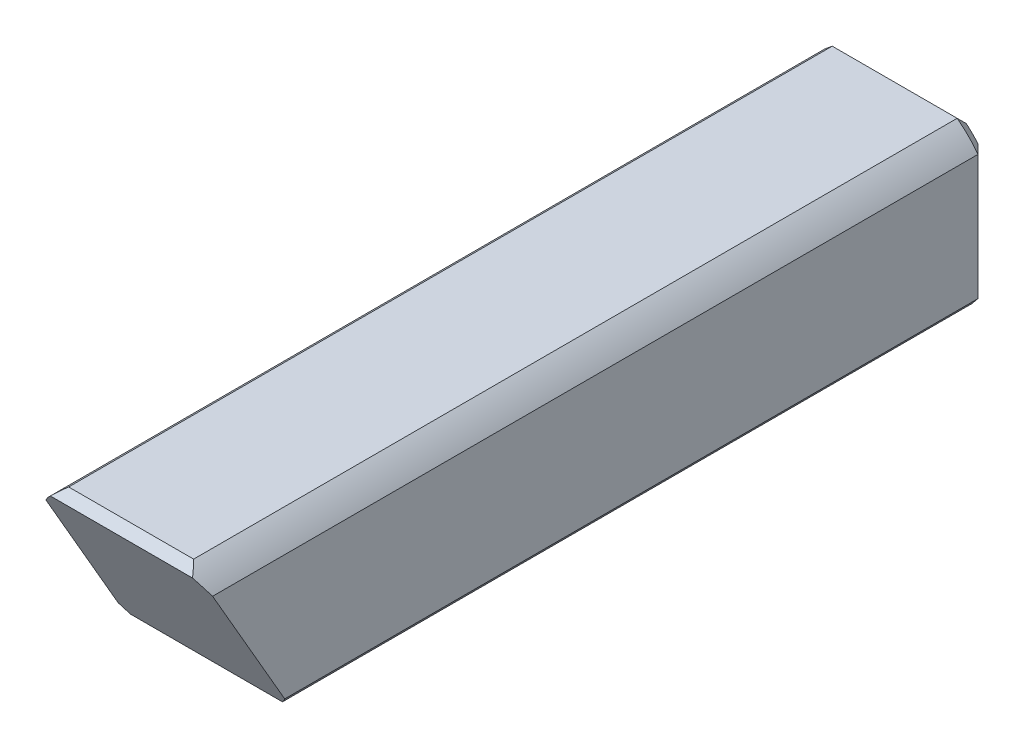
from build123d import *
from OCP.BRepFilletAPI import BRepFilletAPI_MakeChamfer

# Parameters (mm, degrees)
SKETCH_1_W          = 60
SKETCH_1_H          = 60
EXTRUDE_1_DEPTH     = 285
CUT_EXTRUDE_1_DEPTH = 95
SKETCH_3_OUTSIDE_W  = 121.472
SKETCH_3_OUTSIDE_H  = 121.472
SKETCH_3_OUTSIDE_R  = 37.5
CUT_EXTRUDE_2_DEPTH = 289.140590684
CHAMFER_1_SIZE      = 3
CHAMFER_1_SIZE2     = 5
CHAMFER_2_SIZE      = 5


with BuildPart() as part:
    # 草图1 → 凸台-拉伸1 (new body)
    with BuildSketch(Plane.XY):
        Rectangle(SKETCH_1_W, SKETCH_1_H)
    extrude(amount=EXTRUDE_1_DEPTH)

    # 草图2 → 切除-拉伸1 (cut)
    with BuildSketch(Plane(origin=(30, 0, 0), x_dir=(0, 0, -1), z_dir=(1, 0, 0))):
        Polygon((-285, 30), (-250.358983849, -30), (-285, -30), align=None)
    extrude(amount=-CUT_EXTRUDE_1_DEPTH, mode=Mode.SUBTRACT)

    # 草图3 outside → 切除-拉伸2 (cut, through all)
    with BuildSketch(Plane(origin=(0, 0, 0), x_dir=(1, 0, 0), z_dir=(0, 0, -1))):
        Rectangle(SKETCH_3_OUTSIDE_W, SKETCH_3_OUTSIDE_H)
        Circle(SKETCH_3_OUTSIDE_R, mode=Mode.SUBTRACT)
    extrude(amount=-CUT_EXTRUDE_2_DEPTH, mode=Mode.SUBTRACT)

    # 倒角1: one chamfer whose edges measure the first distance from different faces: ONE call of the kernel's chamfer builder (chamfer() names one face for all edges)
    chamfer_1_edges_1 = [part.edges().sort_by_distance(p)[0] for p in [
        (0, -30, 250.358983849),
    ]]
    chamfer_1_side_1 = [part.faces().sort_by_distance(p)[0] for p in [
        (0, -30, 125.179491924),
    ]]
    chamfer_1_edges_2 = [part.edges().sort_by_distance(p)[0] for p in [
        (0, 30, 285),
    ]]
    chamfer_1_side_2 = [part.faces().sort_by_distance(p)[0] for p in [
        (0, 0, 267.679491924),
    ]]
    chamfer_1 = BRepFilletAPI_MakeChamfer(part.part.solid().wrapped)
    for e in chamfer_1_edges_1:
        chamfer_1.Add(CHAMFER_1_SIZE, CHAMFER_1_SIZE2, e.wrapped, chamfer_1_side_1[0].wrapped)  # the first distance lies on this face
    for e in chamfer_1_edges_2:
        chamfer_1.Add(CHAMFER_1_SIZE, CHAMFER_1_SIZE2, e.wrapped, chamfer_1_side_2[0].wrapped)  # the first distance lies on this face
    add(Compound.cast(chamfer_1.Shape()), mode=Mode.REPLACE)

    # 倒角2
    chamfer_2_edges = [part.edges().sort_by_distance(p)[0] for p in [
        (-30, 0, 0),
        (0, 30, 0),
        (30, 0, 0),
        (0, -30, 0),
        (26.516504294, -26.516504294, 0),
        (-26.516504294, 26.516504294, 0),
        (-26.516504294, -26.516504294, 0),
        (26.516504294, 26.516504294, 0),
    ]]
    chamfer(chamfer_2_edges, length=CHAMFER_2_SIZE)


solid = part.part
